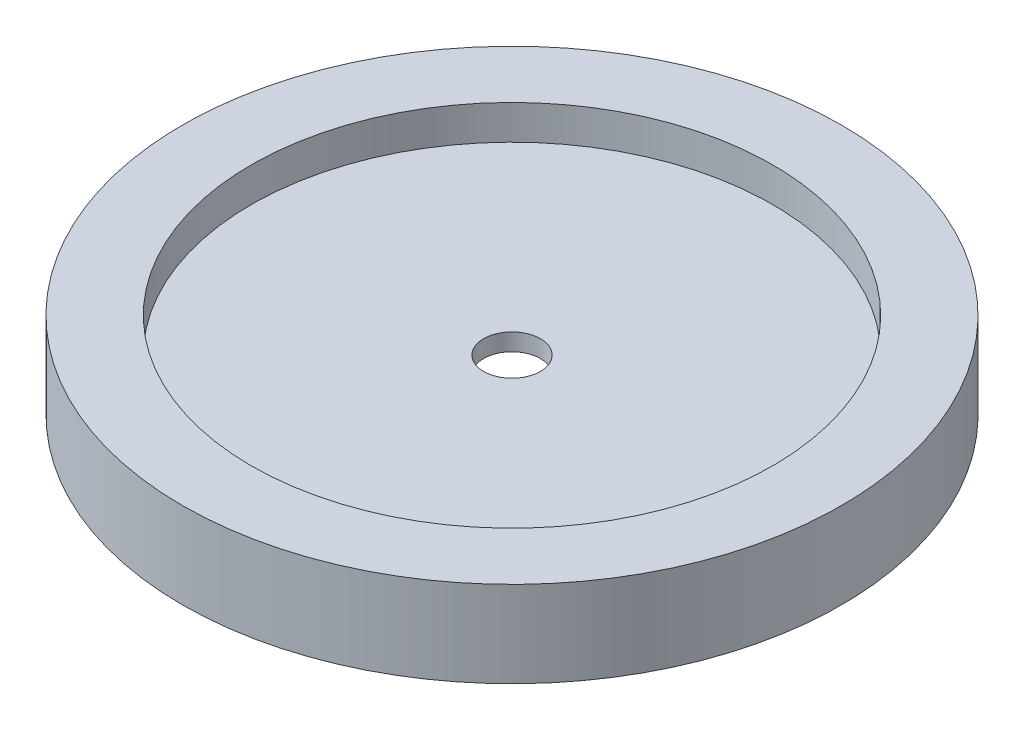
from build123d import *

# Parameters (mm, degrees)
SKETCH1_R           = 9.575
SKETCH1_R_2         = 7.575
BOSS_EXTRUDE1_DEPTH = 1
BOSS_EXTRUDE2_START = 1.5
SKETCH2_R           = 9.575
BOSS_EXTRUDE2_DEPTH = 1.5
SKETCH3_R           = 2.575
CUT_EXTRUDE1_DEPTH  = 1
CHAMFER1_SIZE       = 0.2
SKETCH4_R           = 0.825
CUT_EXTRUDE2_DEPTH  = 14.623921976


with BuildPart() as part:
    # Sketch1 → Boss-Extrude1 (new body)
    with BuildSketch(Plane(origin=(0, 0, 0), x_dir=(1, 0, 0), z_dir=(0, 1, 0))):
        with Locations(Location((0, 0, 0), (0, 0, 270))):
            Circle(SKETCH1_R)
        with Locations(Location((0, 0, 0), (0, 0, 270))):
            Circle(SKETCH1_R_2, mode=Mode.SUBTRACT)
    extrude(amount=BOSS_EXTRUDE1_DEPTH)

    # Sketch2 → Boss-Extrude2 (add)
    with BuildSketch(Plane.XZ.offset(BOSS_EXTRUDE2_START)):
        with Locations(Location((0, 0, 0), (0, 0, 270))):
            Circle(SKETCH2_R)
    extrude(amount=-BOSS_EXTRUDE2_DEPTH)

    # Sketch3 → Cut-Extrude1 (cut)
    with BuildSketch(Plane.XZ.offset(1.5)):
        with Locations(Location((0, 0, 0), (0, 0, 270))):
            Circle(SKETCH3_R)
    extrude(amount=-CUT_EXTRUDE1_DEPTH, mode=Mode.SUBTRACT)

    # Chamfer1
    chamfer1_edges = [part.edges().sort_by_distance(p)[0] for p in [
        (0, -1.5, 2.575),
    ]]
    chamfer(chamfer1_edges, length=CHAMFER1_SIZE)

    # Sketch4 → Cut-Extrude2 (cut, through all)
    with BuildSketch(Plane.XZ.offset(0.5)):
        with Locations(Location((0, 0, 0), (0, 0, 270))):
            Circle(SKETCH4_R)
    extrude(amount=-CUT_EXTRUDE2_DEPTH, mode=Mode.SUBTRACT)


solid = part.part
